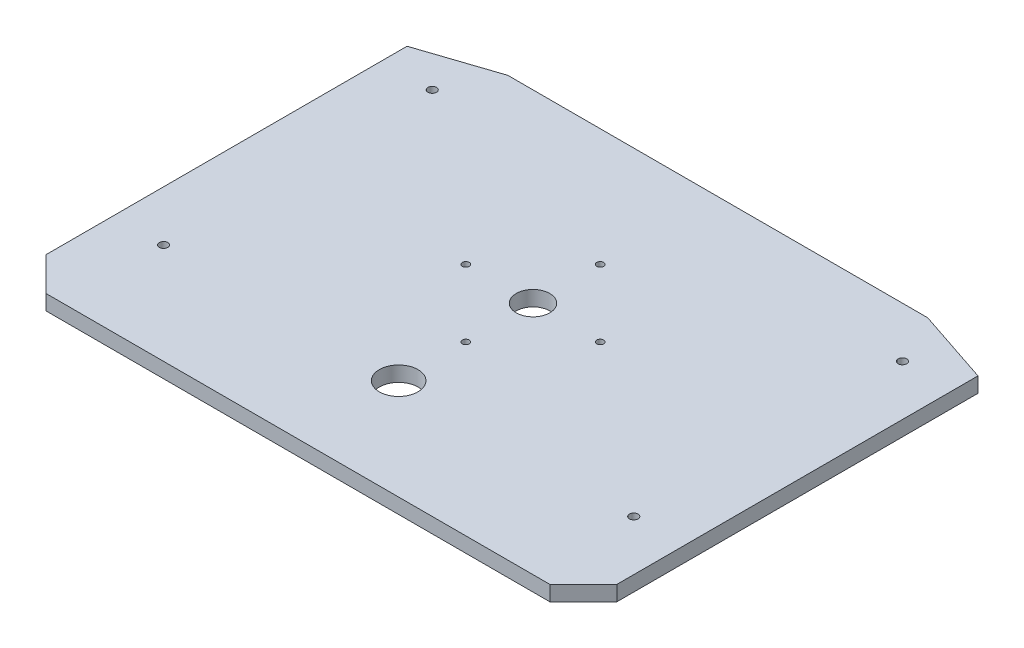
from build123d import *

# Parameters (mm, degrees)
ESQUISSE3_R             = 2.55
STRUCTURE_DEPTH         = 9
ESQUISSE4_R             = 10
ESQUISSE4_R_2           = 11.5
ESQUISSE4_R_3           = 2.05
ENL_V_MAT_EXTRU_1_DEPTH = 10


with BuildPart() as part:
    # Esquisse3 → structure (new body)
    with BuildSketch(Plane(origin=(0, 0, 0), x_dir=(1, 0, 0), z_dir=(0, 1, 0))):
        Polygon((125, 110), (-125, 110), (-170, 95), (-170, 0), (-170, -120), (-150, -140), (-120, -140), (120, -140), (150, -140), (170, -120), (170, 0), (170, 95), align=None)
        with Locations(Location((-140, 80, 0), (0, 0, 270))):
            Circle(ESQUISSE3_R, mode=Mode.SUBTRACT)
        with Locations(Location((-140, -80, 0), (0, 0, 90))):
            Circle(ESQUISSE3_R, mode=Mode.SUBTRACT)
        with Locations(Location((140, -80, 0), (0, 0, 270))):
            Circle(ESQUISSE3_R, mode=Mode.SUBTRACT)
        with Locations(Location((140, 80, 0), (0, 0, 90))):
            Circle(ESQUISSE3_R, mode=Mode.SUBTRACT)
    extrude(amount=-STRUCTURE_DEPTH)

    # Esquisse4 → Enlèv. mat.-Extru.1 (cut)
    with BuildSketch(Plane(origin=(0, 0, 0), x_dir=(1, 0, 0), z_dir=(0, 1, 0))):
        with Locations(Location((0, 0, 0), (0, 0, 270))):
            Circle(ESQUISSE4_R)
        with Locations(Location((0, -80, 0), (0, 0, 270))):
            Circle(ESQUISSE4_R_2)
        with Locations(Location((0, 40, 0), (0, 0, 270))):
            Circle(ESQUISSE4_R_3)
        with Locations(Location((40, 0, 0), (0, 0, 270))):
            Circle(ESQUISSE4_R_3)
        with Locations(Location((0, -40, 0), (0, 0, 270))):
            Circle(ESQUISSE4_R_3)
        with Locations(Location((-40, 0, 0), (0, 0, 270))):
            Circle(ESQUISSE4_R_3)
    extrude(amount=-ENL_V_MAT_EXTRU_1_DEPTH, mode=Mode.SUBTRACT)


solid = part.part
